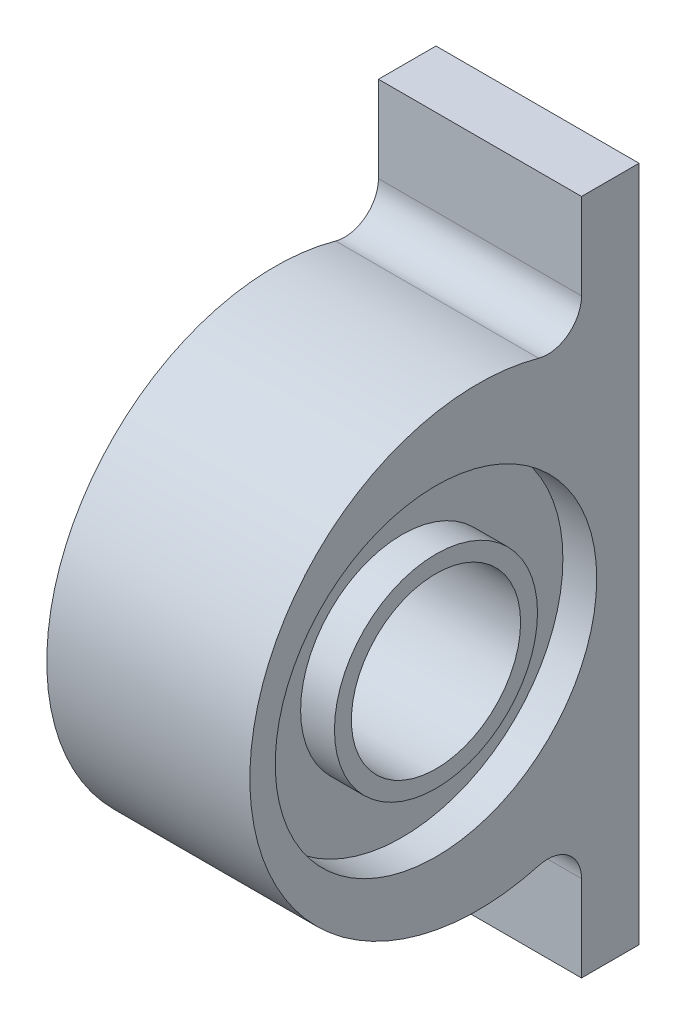
from build123d import *

# Parameters (mm, degrees)
BOSS_EXTRUDE1_DEPTH      = 30
FILLET1_R                = 10
CUT_EXTRUDE1_DEPTH       = 156.32224567
CUT_EXTRUDE1_DEPTH_BACK  = 156.32224567
SKETCH2_R                = 25
CUT_EXTRUDE2_START       = -30
SKETCH3_R                = 47.5
CUT_EXTRUDE2_DEPTH       = 10
CUT_EXTRUDE3_START       = 20
SKETCH3_3_R              = 47.5
CUT_EXTRUDE3_DEPTH       = 10
BOSS_EXTRUDE2_DEPTH      = 30
BOSS_EXTRUDE2_DEPTH_BACK = 30
SKETCH4_R                = 30
SKETCH4_R_2              = 25


with BuildPart() as part:
    # Sketch1 → Boss-Extrude1 (new, symmetric)
    with BuildSketch(Plane(origin=(0, 0, 0), x_dir=(0, 0, -1), z_dir=(1, 0, 0))):
        with BuildLine():
            Line((0, -100), (0, 100))
            Line((0, 100), (-17, 100))
            Line((-17, 100), (-17, 60))
            ThreePointArc((-17, 60), (-115, 0), (-17, -60))
            Line((-17, -60), (-17, -100))
            Line((-17, -100), (0, -100))
        make_face()
    extrude(amount=BOSS_EXTRUDE1_DEPTH, both=True)

    # Fillet1
    fillet1_edges = [part.edges().sort_by_distance(p)[0] for p in [
        (0, -60, 17),
        (0, 60, 17),
    ]]
    fillet(fillet1_edges, radius=FILLET1_R)

    # Sketch2 → Cut-Extrude1 (cut, two sides: drawn at the far end of the back side and taken through both)
    with BuildSketch(Plane(origin=(0, 0, 0), x_dir=(0, 0, -1), z_dir=(1, 0, 0)).offset(-CUT_EXTRUDE1_DEPTH_BACK)):
        with Locations((-60, 0)):
            Circle(SKETCH2_R)
    extrude(amount=CUT_EXTRUDE1_DEPTH + CUT_EXTRUDE1_DEPTH_BACK, mode=Mode.SUBTRACT)

    # Sketch3 → Cut-Extrude2 (cut)
    with BuildSketch(Plane(origin=(0, 0, 0), x_dir=(0, 0, -1), z_dir=(1, 0, 0)).offset(CUT_EXTRUDE2_START)):
        with Locations((-60, 0)):
            Circle(SKETCH3_R)
    extrude(amount=CUT_EXTRUDE2_DEPTH, mode=Mode.SUBTRACT)

    # Sketch3<3> → Cut-Extrude3 (cut)
    with BuildSketch(Plane(origin=(0, 0, 0), x_dir=(0, 0, -1), z_dir=(1, 0, 0)).offset(CUT_EXTRUDE3_START)):
        with Locations((-60, 0)):
            Circle(SKETCH3_3_R)
    extrude(amount=CUT_EXTRUDE3_DEPTH, mode=Mode.SUBTRACT)

    # Sketch4 → Boss-Extrude2 (add, two sides: drawn at the far end of the back side and taken through both)
    with BuildSketch(Plane(origin=(0, 0, 0), x_dir=(0, 0, -1), z_dir=(1, 0, 0)).offset(-BOSS_EXTRUDE2_DEPTH_BACK)):
        with Locations((-60, 0)):
            Circle(SKETCH4_R)
        with Locations((-60, 0)):
            Circle(SKETCH4_R_2, mode=Mode.SUBTRACT)
    extrude(amount=BOSS_EXTRUDE2_DEPTH + BOSS_EXTRUDE2_DEPTH_BACK)


solid = part.part
